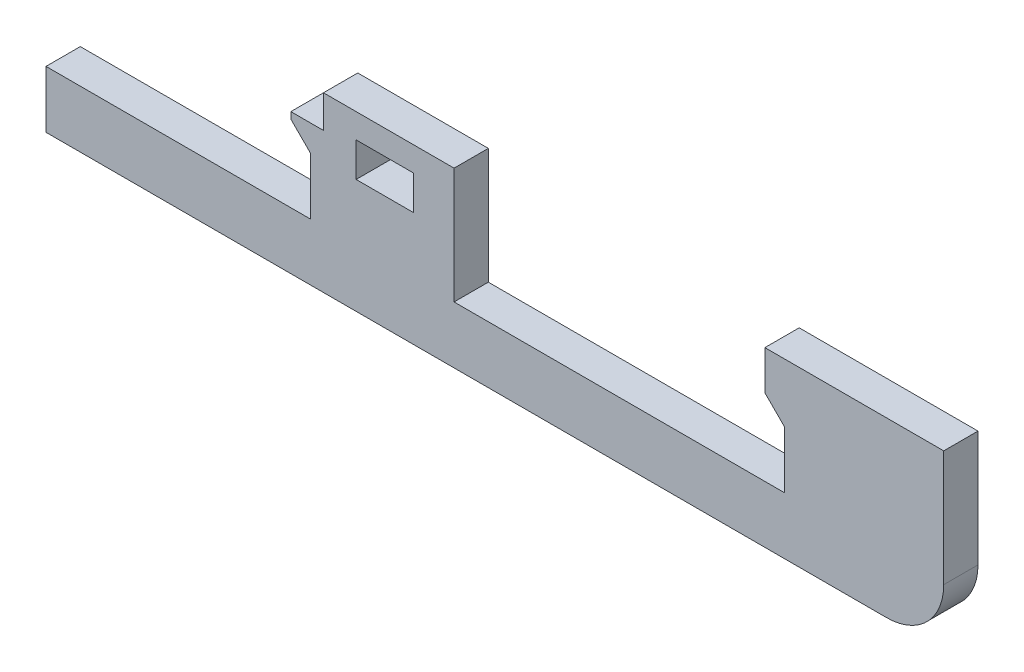
from build123d import *

# Parameters (mm, degrees)
SKETCH1_W               = 139.7
SKETCH1_H               = 26.924
BOSS_EXTRUDE1_DEPTH     = 5.334
SKETCH2_W               = 38.1
SKETCH2_H               = 18.034
CUT_EXTRUDE1_DEPTH      = 104.832998003
SKETCH3_W               = 48.37176
SKETCH3_H               = 18.034
CUT_EXTRUDE3_DEPTH      = 104.832998003
SKETCH4_W               = 5.08
SKETCH4_H               = 5.08
CUT_EXTRUDE4_DEPTH      = 104.832998003
FILLET1_R               = 8.89
SKETCH5_W               = 8.89
SKETCH5_H               = 5.334
CUT_EXTRUDE5_DEPTH      = 104.832998003
SKETCH6_W               = 3.048
SKETCH6_H               = 8.89
CUT_EXTRUDE6_DEPTH      = 104.832998003
CUT_EXTRUDE7_DEPTH      = 104.832998003
CUT_EXTRUDE8_DEPTH      = 104.832998003
CUT_EXTRUDE9_DEPTH      = 104.832998003
CUT_EXTRUDE9_DEPTH_BACK = 104.832998003


with BuildPart() as part:
    # Sketch1 → Boss-Extrude1 (new body)
    with BuildSketch(Plane.XY):
        with Locations((32.120305114, 5.376704658)):
            Rectangle(SKETCH1_W, SKETCH1_H)
    extrude(amount=BOSS_EXTRUDE1_DEPTH)

    # Sketch2 → Cut-Extrude1 (cut, through all)
    with BuildSketch(Plane.XY.offset(5.334)):
        with Locations((-18.679694886, 9.821704658)):
            Rectangle(SKETCH2_W, SKETCH2_H)
    extrude(amount=-CUT_EXTRUDE1_DEPTH, mode=Mode.SUBTRACT)

    # Sketch3 → Cut-Extrude3 (cut, through all)
    with BuildSketch(Plane.XY.offset(5.334)):
        with Locations((49.956185114, 9.821704658)):
            Rectangle(SKETCH3_W, SKETCH3_H)
    extrude(amount=-CUT_EXTRUDE3_DEPTH, mode=Mode.SUBTRACT)

    # Sketch4 → Cut-Extrude4 (cut, through all)
    with BuildSketch(Plane.XY.offset(5.334)):
        with Locations((2.910305114, 16.298704658)):
            Rectangle(SKETCH4_W, SKETCH4_H)
    extrude(amount=-CUT_EXTRUDE4_DEPTH, mode=Mode.SUBTRACT)

    # Fillet1
    fillet1_edges = [part.edges().sort_by_distance(p)[0] for p in [
        (101.970305114, -8.085295342, 2.667),
    ]]
    fillet(fillet1_edges, radius=FILLET1_R)

    # Sketch5 → Cut-Extrude5 (cut, through all)
    with BuildSketch(Plane.XY.offset(5.334)):
        with Locations((14.975305114, 12.361704658)):
            Rectangle(SKETCH5_W, SKETCH5_H)
    extrude(amount=-CUT_EXTRUDE5_DEPTH, mode=Mode.SUBTRACT)

    # Sketch6 → Cut-Extrude6 (cut, through all)
    with BuildSketch(Plane.XY.offset(5.334)):
        with Locations((75.666065114, 5.249704658)):
            Rectangle(SKETCH6_W, SKETCH6_H)
    extrude(amount=-CUT_EXTRUDE6_DEPTH, mode=Mode.SUBTRACT)

    # Sketch7 → Cut-Extrude7 (cut, through all)
    with BuildSketch(Plane.XY.offset(5.334)):
        Polygon((77.190065114, 9.694704658), (74.142065114, 12.742704658), (74.142065114, 9.694704658), align=None)
    extrude(amount=-CUT_EXTRUDE7_DEPTH, mode=Mode.SUBTRACT)

    # Sketch8 → Cut-Extrude8 (cut, through all)
    with BuildSketch(Plane.XY.offset(5.334)):
        Polygon((0.370305114, 1.312704658), (3.418305114, 4.360704658), (3.418305114, 9.694704658), (0.370305114, 12.742704658), align=None)
    extrude(amount=-CUT_EXTRUDE8_DEPTH, mode=Mode.SUBTRACT)

    # Sketch9 → Cut-Extrude9 (cut, two sides: drawn at the far end of the back side and taken through both)
    with BuildSketch(Plane.XY.offset(5.334).offset(-CUT_EXTRUDE9_DEPTH_BACK)):
        Polygon((3.418305114, 0.804704658), (3.418305114, 4.360704658), (0.370305114, 1.312704658), (0.370305114, 0.804704658), align=None)
    extrude(amount=CUT_EXTRUDE9_DEPTH + CUT_EXTRUDE9_DEPTH_BACK, mode=Mode.SUBTRACT)


solid = part.part
